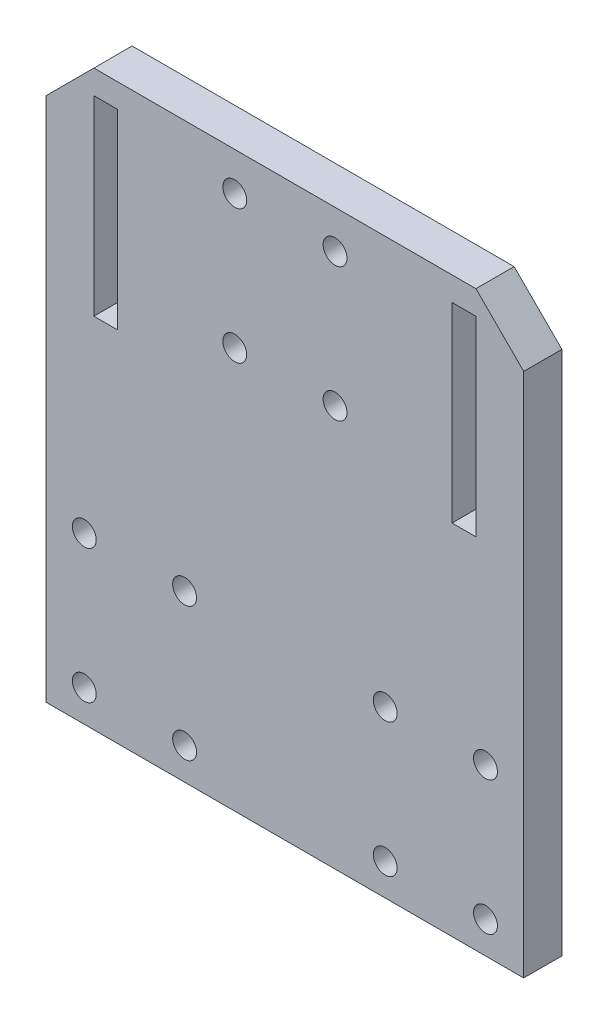
from build123d import *

# Parameters (mm, degrees)
SKETCH1_W           = 100
SKETCH1_H           = 120
SKETCH1_R           = 2.5
SKETCH1_W_2         = 5
SKETCH1_H_2         = 40
BOSS_EXTRUDE1_DEPTH = 4
CHAMFER1_SIZE       = 10


with BuildPart() as part:
    # Sketch1 → Boss-Extrude1 (new, symmetric)
    with BuildSketch(Plane.XY):
        with Locations((0, 60)):
            Rectangle(SKETCH1_W, SKETCH1_H)
        with Locations((-42, 6.66986634)):
            Circle(SKETCH1_R, mode=Mode.SUBTRACT)
        with Locations((-42, 34.66986634)):
            Circle(SKETCH1_R, mode=Mode.SUBTRACT)
        with Locations((-10.5, 112)):
            Circle(SKETCH1_R, mode=Mode.SUBTRACT)
        with Locations((-10.5, 84)):
            Circle(SKETCH1_R, mode=Mode.SUBTRACT)
        with Locations((10.5, 84)):
            Circle(SKETCH1_R, mode=Mode.SUBTRACT)
        with Locations((10.5, 112)):
            Circle(SKETCH1_R, mode=Mode.SUBTRACT)
        with Locations((-21, 6.66986634)):
            Circle(SKETCH1_R, mode=Mode.SUBTRACT)
        with Locations((-21, 34.66986634)):
            Circle(SKETCH1_R, mode=Mode.SUBTRACT)
        with Locations((21, 34.66986634)):
            Circle(SKETCH1_R, mode=Mode.SUBTRACT)
        with Locations((21, 6.66986634)):
            Circle(SKETCH1_R, mode=Mode.SUBTRACT)
        with Locations((42, 34.66986634)):
            Circle(SKETCH1_R, mode=Mode.SUBTRACT)
        with Locations((42, 6.66986634)):
            Circle(SKETCH1_R, mode=Mode.SUBTRACT)
        with Locations((37.5, 95)):
            Rectangle(SKETCH1_W_2, SKETCH1_H_2, mode=Mode.SUBTRACT)
        with Locations((-37.5, 95)):
            Rectangle(SKETCH1_W_2, SKETCH1_H_2, mode=Mode.SUBTRACT)
    extrude(amount=BOSS_EXTRUDE1_DEPTH, both=True)

    # Chamfer1
    chamfer1_edges = [part.edges().sort_by_distance(p)[0] for p in [
        (50, 120, 0),
        (-50, 120, 0),
    ]]
    chamfer(chamfer1_edges, length=CHAMFER1_SIZE)


solid = part.part
